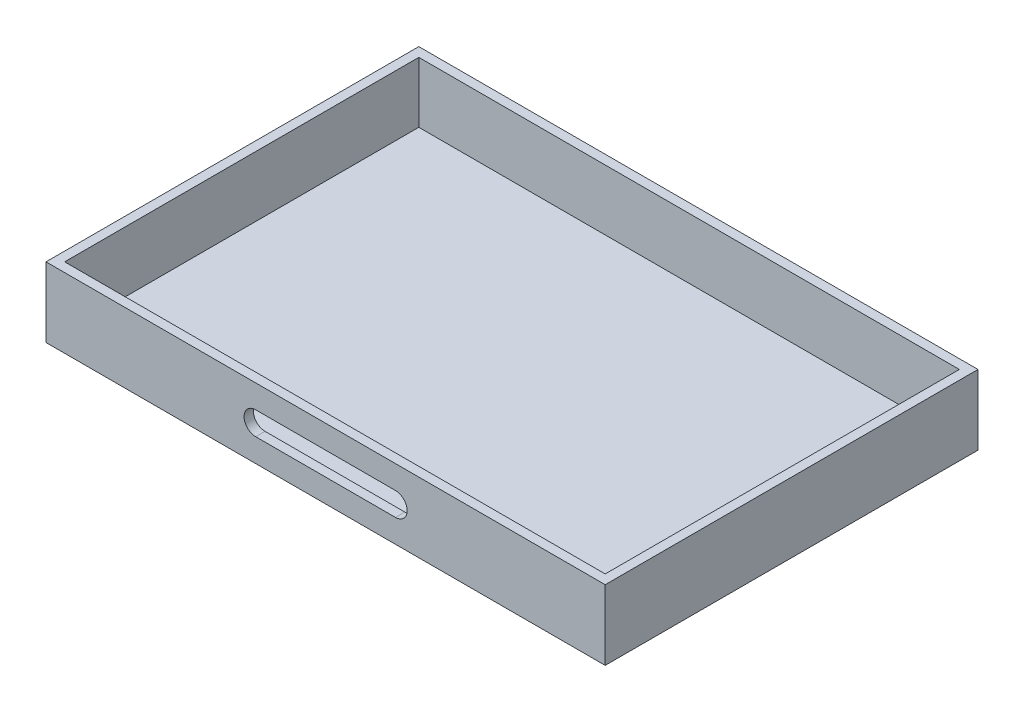
from build123d import *

# Parameters (mm, degrees)
ESBO_O1_W                = 120
ESBO_O1_H                = 80
RESSALTO_EXTRUS_O2_DEPTH = 2
ESBO_O2_W                = 120
ESBO_O2_H                = 80
ESBO_O2_W_2              = 116
ESBO_O2_H_2              = 76
EXTRUS_O_FINA1_DEPTH     = 13
CORTE_EXTRUS_O1_DEPTH    = 2


with BuildPart() as part:
    # Esboço1 → Ressalto-extrusão2 (new body)
    with BuildSketch(Plane(origin=(0, 0, 0), x_dir=(1, 0, 0), z_dir=(0, 1, 0))):
        Rectangle(ESBO_O1_W, ESBO_O1_H)
    extrude(amount=RESSALTO_EXTRUS_O2_DEPTH)

    # Esboço2 → Extrusão-Fina1 (add)
    with BuildSketch(Plane(origin=(0, 2, 0), x_dir=(1, 0, 0), z_dir=(0, 1, 0))):
        Rectangle(ESBO_O2_W, ESBO_O2_H)
        Rectangle(ESBO_O2_W_2, ESBO_O2_H_2, mode=Mode.SUBTRACT)
    extrude(amount=EXTRUS_O_FINA1_DEPTH)

    # Esboço3 → Corte-extrusão1 (cut)
    with BuildSketch(Plane.XY.offset(40)):
        with BuildLine():
            Line((-15, 10), (15, 10))
            ThreePointArc((15, 10), (17.5, 7.5), (15, 5))
            Line((15, 5), (-15, 5))
            ThreePointArc((-15, 5), (-17.5, 7.5), (-15, 10))
        make_face()
    extrude(amount=-CORTE_EXTRUS_O1_DEPTH, mode=Mode.SUBTRACT)


solid = part.part
